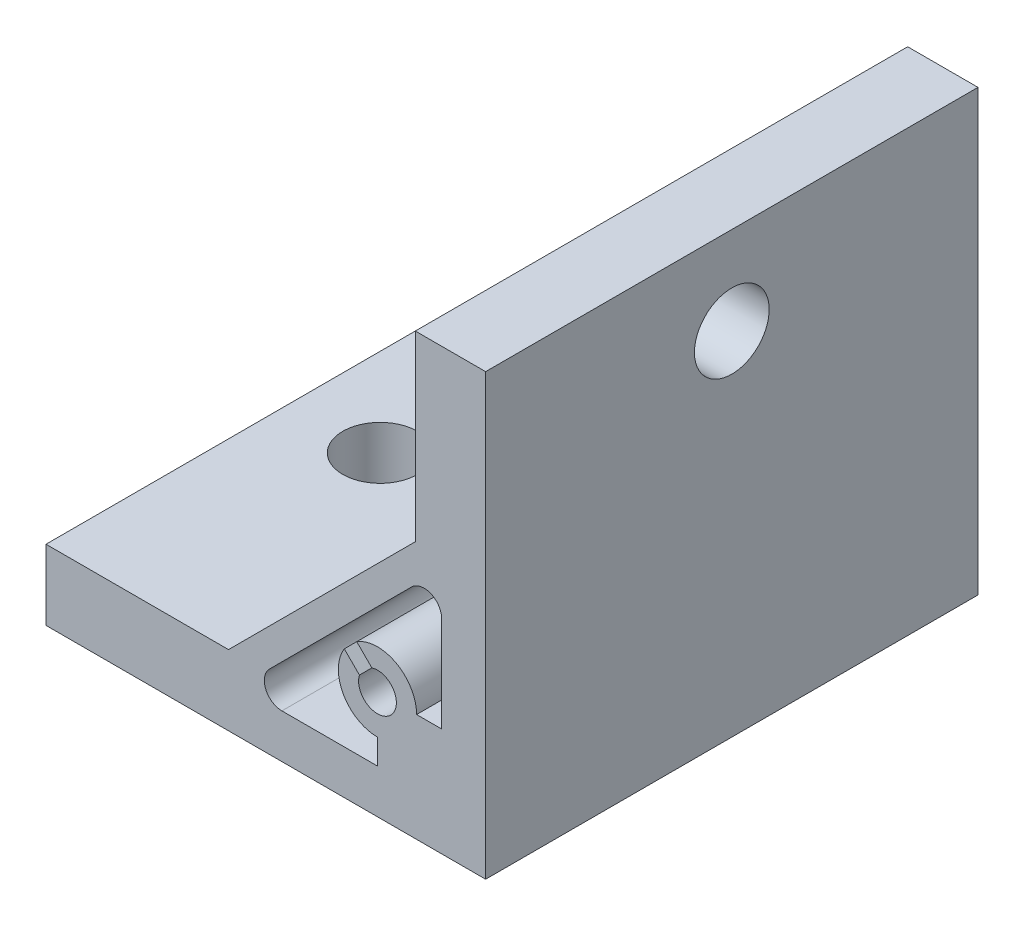
from build123d import *

# Parameters (mm, degrees)
EXTRUDE_1_DEPTH     = 28
SKETCH_3_R          = 4.25
CUT_EXTRUDE_1_DEPTH = 72.049278673


with BuildPart() as part:
    # 草图1 → 凸台-拉伸1 (new, symmetric)
    with BuildSketch(Plane.XY):
        Polygon((0, 0), (50, 0), (50, 50), (42, 50), (42, 29.242640687), (20.757359313, 8), (0, 8), align=None)
        with BuildLine():
            Line((37.061279898, 14.352933665), (35.340960992, 16.07325257))
            ThreePointArc((35.340960992, 16.07325257), (39.856939547, 16.192314452), (42.15, 12.3))
            Line((42.15, 12.3), (45, 12.3))
            Line((45, 12.3), (45, 23.171572875))
            ThreePointArc((45, 23.171572875), (43.765366865, 25.01933194), (41.585786438, 24.585786438))
            Line((41.585786438, 24.585786438), (25.414213562, 8.414213562))
            ThreePointArc((25.414213562, 8.414213562), (24.98066806, 6.234633135), (26.828427125, 5))
            Line((26.828427125, 5), (37.7, 5))
            Line((37.7, 5), (37.7, 7.85))
            ThreePointArc((37.7, 7.85), (33.807685548, 10.143060453), (33.92674743, 14.659039008))
            Line((33.92674743, 14.659039008), (35.647066335, 12.938720102))
            ThreePointArc((35.647066335, 12.938720102), (39.22027958, 10.77972042), (37.061279898, 14.352933665))
        make_face(mode=Mode.SUBTRACT)
    extrude(amount=EXTRUDE_1_DEPTH, both=True)

    # 草图3 → 切除-拉伸1 (cut, through all)
    with BuildSketch(Plane(origin=(0, 8, 0), x_dir=(1, 0, 0), z_dir=(0, 1, 0))):
        with Locations(Location((10, 0, 0), (0, 0, 270))):
            Circle(SKETCH_3_R)
    cut_extrude_1 = extrude(amount=-CUT_EXTRUDE_1_DEPTH, mode=Mode.SUBTRACT)

    # 镜向1: 切除-拉伸1 across plane
    add(cut_extrude_1.mirror(Plane(origin=(25, 25, 0), x_dir=(0, 0, 1), z_dir=(-0.7071067811865486, -0.7071067811865465, 0))), mode=Mode.SUBTRACT)


solid = part.part
